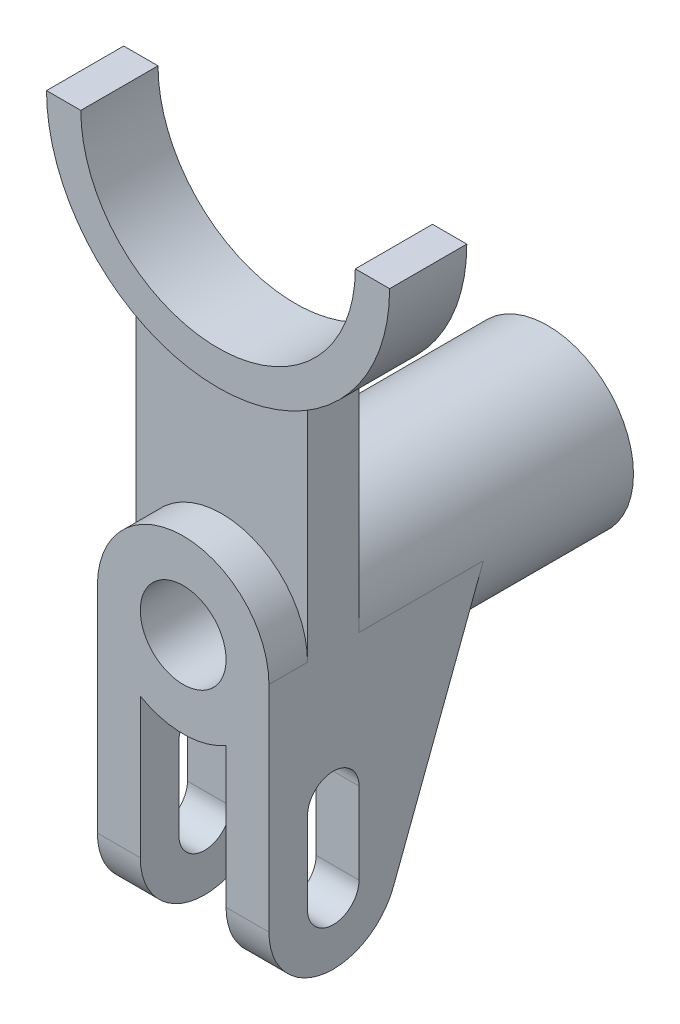
from build123d import *

# Parameters (mm, degrees)
BOSS_EXTRUDE1_DEPTH      = 9
BOSS_EXTRUDE2_DEPTH      = 6
BOSS_EXTRUDE3_DEPTH      = 15
BOSS_EXTRUDE3_DEPTH_BACK = 70
SKETCH1_4_R              = 20
BOSS_EXTRUDE4_DEPTH      = 10
SKETCH3_W                = 10
SKETCH3_H                = 85.001


with BuildPart() as part:
    # Sketch1 → Boss-Extrude1 (new, symmetric)
    with BuildSketch(Plane.XY):
        with BuildLine():
            ThreePointArc((-29.862613088, 88), (2.137386912, 56), (34.137386912, 88))
            Line((34.137386912, 88), (42.137386912, 88))
            ThreePointArc((42.137386912, 88), (2.137386912, 48), (-37.862613088, 88))
            Line((-37.862613088, 88), (-29.862613088, 88))
        make_face()
    extrude(amount=BOSS_EXTRUDE1_DEPTH, both=True)

    # Sketch1<3> → Boss-Extrude2 (add, symmetric)
    with BuildSketch(Plane.XY):
        with BuildLine():
            ThreePointArc((20, 52.209958736), (-0.332230393, 48.076310411), (-20, 54.684296485))
            Line((-20, 54.684296485), (-20, 0))
            ThreePointArc((-20, 0), (0, 20), (20, 0))
            Line((20, 0), (20, 52.209958736))
        make_face()
    extrude(amount=BOSS_EXTRUDE2_DEPTH, both=True)

    # Sketch1<4> → Boss-Extrude3 (add, two sides: drawn at the far end of the back side and taken through both)
    with BuildSketch(Plane.XY.offset(-BOSS_EXTRUDE3_DEPTH_BACK)):
        Circle(SKETCH1_4_R)
    extrude(amount=BOSS_EXTRUDE3_DEPTH + BOSS_EXTRUDE3_DEPTH_BACK)

    # Sketch2 → Boss-Extrude4 (add)
    with BuildSketch(Plane(origin=(20, 0, 0), x_dir=(0, 0, -1), z_dir=(1, 0, 0))):
        with BuildLine():
            Line((-15, 0), (-15, -50))
            ThreePointArc((-15, -50), (-2.703242507, -64.754405442), (14.025663993, -55.317964795))
            Line((14.025663993, -55.317964795), (35, 0))
            Line((35, 0), (-15, 0))
        make_face()
        with BuildLine():
            Line((-6, -50), (-6, -31))
            ThreePointArc((-6, -31), (0, -25), (6, -31))
            Line((6, -31), (6, -50))
            ThreePointArc((6, -50), (0, -56), (-6, -50))
        make_face(mode=Mode.SUBTRACT)
    boss_extrude4 = extrude(amount=-BOSS_EXTRUDE4_DEPTH)

    # Mirror1: Boss-Extrude4 across plane
    add(boss_extrude4.mirror(Plane(origin=(0, 0, 0), x_dir=(0, 0, 1), z_dir=(1, 0, 0))))

    # Sketch3 → Ø20.0 (20) Diameter Hole1 (revolve, cut)
    with BuildSketch(Plane(origin=(0, 0, 15), x_dir=(0, -1, 0), z_dir=(1, 0, 0))):
        with Locations((5, 42.5005)):
            Rectangle(SKETCH3_W, SKETCH3_H)
    revolve(axis=Axis((0, 0, 21.35), (0, 0, -1)), mode=Mode.SUBTRACT)


solid = part.part
